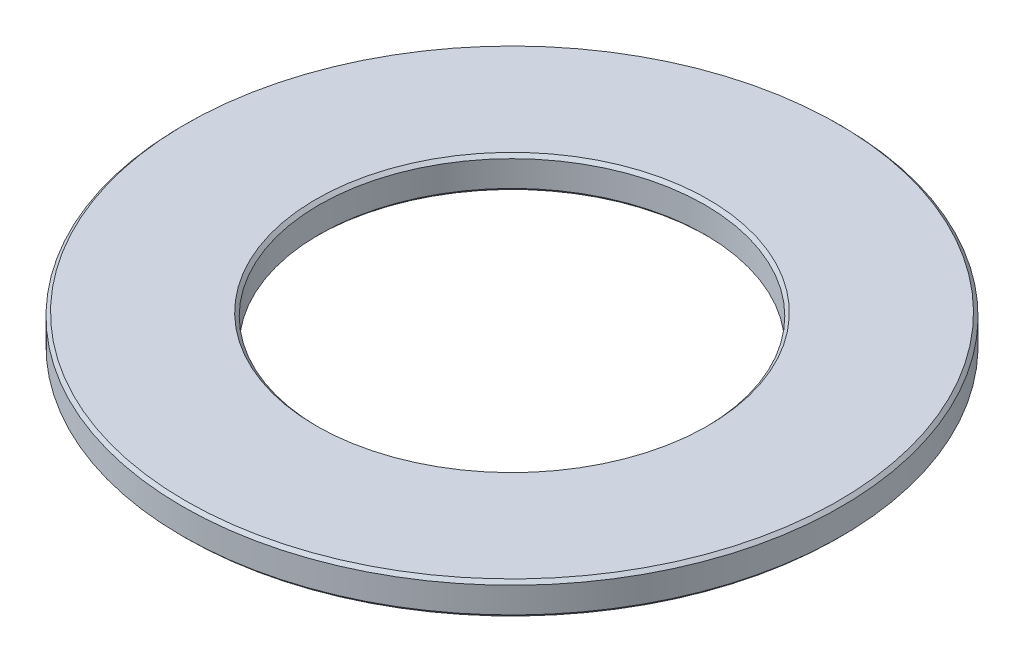
from build123d import *

# Parameters (mm, degrees)
PROFILES_R    = 10.25
PROFILES_R_2  = 6
PROFILE_DEPTH = 1
OUTERC_SIZE   = 0.1
INNERC_SIZE   = 0.1


with BuildPart() as part:
    # ProfileS → Profile (new body)
    with BuildSketch(Plane(origin=(0, 0, 0), x_dir=(1, 0, 0), z_dir=(0, 1, 0))):
        with Locations(Location((0, 0, 0), (0, 0, 270))):
            Circle(PROFILES_R)
        with Locations(Location((0, 0, 0), (0, 0, 270))):
            Circle(PROFILES_R_2, mode=Mode.SUBTRACT)
    extrude(amount=PROFILE_DEPTH)

    # OuterC
    outerc_edges = [part.edges().sort_by_distance(p)[0] for p in [
        (0, 0, -10.25),
        (0, 1, -10.25),
    ]]
    chamfer(outerc_edges, length=OUTERC_SIZE)

    # InnerC
    innerc_edges = [part.edges().sort_by_distance(p)[0] for p in [
        (0, 0, -6),
        (0, 1, -6),
    ]]
    chamfer(innerc_edges, length=INNERC_SIZE)


solid = part.part
